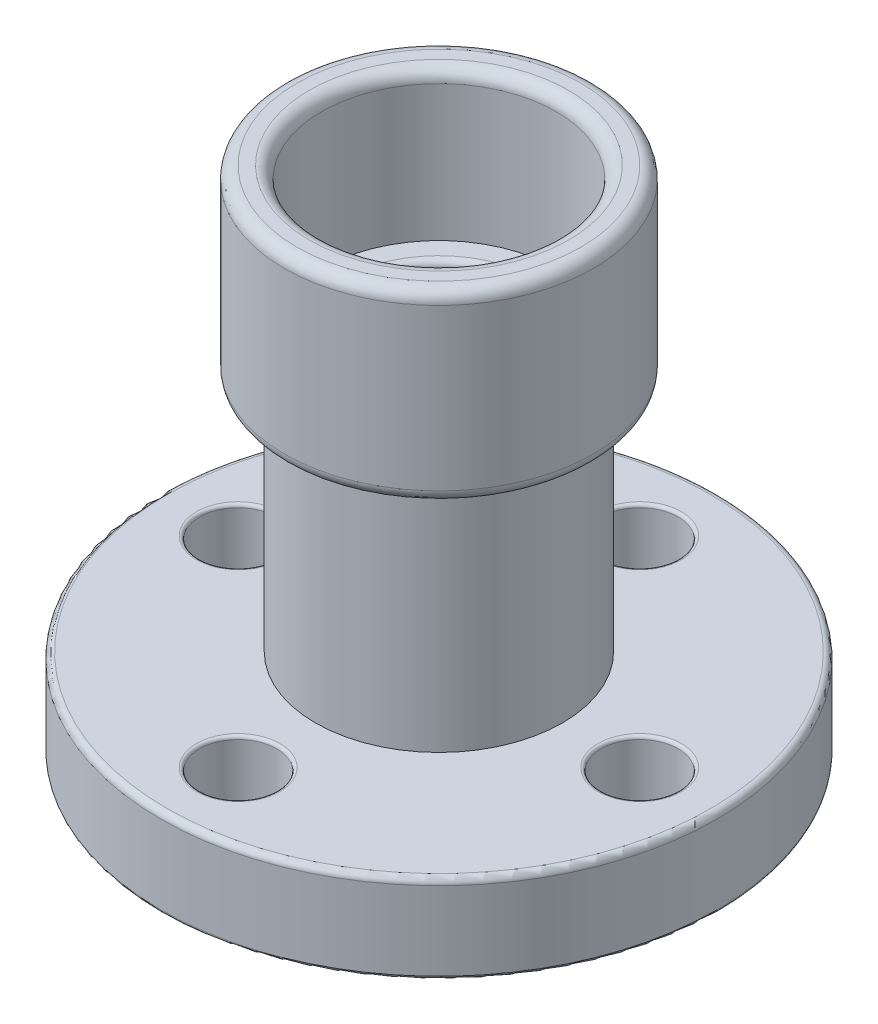
from build123d import *

# Parameters (mm, degrees)
SKETCH1_R           = 45
SKETCH1_R_2         = 20
SKETCH1_R_3         = 15
BOSS_EXTRUDE2_DEPTH = 14.2
BOSS_EXTRUDE3_START = 44.2
SKETCH2_R           = 20
SKETCH2_R_2         = 15
BOSS_EXTRUDE3_DEPTH = 44.2
BOSS_EXTRUDE4_START = 24
SKETCH3_R           = 25
SKETCH3_R_2         = 20
SKETCH3_R_3         = 19
BOSS_EXTRUDE4_DEPTH = 24
SKETCH4_R           = 25
SKETCH4_R_2         = 15
BOSS_EXTRUDE5_DEPTH = 6
SKETCH5_R           = 6.25
CUT_EXTRUDE1_DEPTH  = 24
FILLET1_R           = 1
FILLET2_R           = 2
FILLET3_R           = 1
FILLET4_R           = 0.5
FILLET5_R           = 0.5
FILLET6_R           = 1


with BuildPart() as part:
    # Sketch1 → Boss-Extrude2 (new body)
    # profile 1 of 2: a face of its own
    with BuildSketch(Plane(origin=(0, 0, 0), x_dir=(1, 0, 0), z_dir=(0, 1, 0))):
        with Locations(Location((0, 0, 0), (0, 0, 270))):
            Circle(SKETCH1_R)
        Circle(SKETCH1_R_2, mode=Mode.SUBTRACT)
    # profile 2 of 2: a face of its own
    with BuildSketch(Plane(origin=(0, 0, 0), x_dir=(1, 0, 0), z_dir=(0, 1, 0))):
        Circle(SKETCH1_R_2)
        with Locations(Location((0, 0, 0), (0, 0, 270))):
            Circle(SKETCH1_R_3, mode=Mode.SUBTRACT)
    extrude(amount=-BOSS_EXTRUDE2_DEPTH)

    # Sketch2 → Boss-Extrude3 (add)
    with BuildSketch(Plane(origin=(0, 0, 0), x_dir=(1, 0, 0), z_dir=(0, 1, 0)).offset(BOSS_EXTRUDE3_START)):
        with Locations(Location((0, 0, 0), (0, 0, 270))):
            Circle(SKETCH2_R)
        with Locations(Location((0, 0, 0), (0, 0, 270))):
            Circle(SKETCH2_R_2, mode=Mode.SUBTRACT)
    extrude(amount=-BOSS_EXTRUDE3_DEPTH)

    # Sketch3 → Boss-Extrude4 (add)
    # profile 1 of 2: a face of its own
    with BuildSketch(Plane(origin=(0, 44.2, 0), x_dir=(1, 0, 0), z_dir=(0, 1, 0)).offset(BOSS_EXTRUDE4_START)):
        with Locations(Location((0, 0, 0), (0, 0, 270))):
            Circle(SKETCH3_R)
        with Locations(Location((0, 0, 0), (0, 0, 270))):
            Circle(SKETCH3_R_2, mode=Mode.SUBTRACT)
    # profile 2 of 2: a face of its own
    with BuildSketch(Plane(origin=(0, 44.2, 0), x_dir=(1, 0, 0), z_dir=(0, 1, 0)).offset(BOSS_EXTRUDE4_START)):
        with Locations(Location((0, 0, 0), (0, 0, 270))):
            Circle(SKETCH3_R_2)
        with Locations(Location((0, 0, 0), (0, 0, 270))):
            Circle(SKETCH3_R_3, mode=Mode.SUBTRACT)
    extrude(amount=-BOSS_EXTRUDE4_DEPTH)

    # Sketch4 → Boss-Extrude5 (add)
    with BuildSketch(Plane.XZ.offset(-44.2)):
        with Locations(Location((0, 0, 0), (0, 0, 270))):
            Circle(SKETCH4_R)
        with Locations(Location((0, 0, 0), (0, 0, 90))):
            Circle(SKETCH4_R_2, mode=Mode.SUBTRACT)
    extrude(amount=BOSS_EXTRUDE5_DEPTH)

    # Sketch5 → Cut-Extrude1 (cut)
    with BuildSketch(Plane(origin=(0, 0, 0), x_dir=(1, 0, 0), z_dir=(0, 1, 0))):
        with Locations(Location((0, 32.5, 0), (0, 0, 270))):
            Circle(SKETCH5_R)
        with Locations(Location((32.5, 0, 0), (0, 0, 270))):
            Circle(SKETCH5_R)
        with Locations(Location((0, -32.5, 0), (0, 0, 270))):
            Circle(SKETCH5_R)
        with Locations(Location((-32.5, 0, 0), (0, 0, 270))):
            Circle(SKETCH5_R)
    extrude(amount=-CUT_EXTRUDE1_DEPTH, mode=Mode.SUBTRACT)

    # Fillet1
    fillet1_edges = [part.edges().sort_by_distance(p)[0] for p in [
        (0, 0, -45),
    ]]
    fillet(fillet1_edges, radius=FILLET1_R)

    # Fillet2
    fillet2_edges = [part.edges().sort_by_distance(p)[0] for p in [
        (0, 68.2, -19),
        (0, 68.2, -25),
        (0, 38.2, 25),
    ]]
    fillet(fillet2_edges, radius=FILLET2_R)

    # Fillet3
    fillet3_edges = [part.edges().sort_by_distance(p)[0] for p in [
        (0, 44.2, -15),
    ]]
    fillet(fillet3_edges, radius=FILLET3_R)

    # Fillet4
    fillet4_edges = [part.edges().sort_by_distance(p)[0] for p in [
        (0, 0, -38.75),
        (32.5, 0, -6.25),
        (0, 0, 26.25),
        (-32.5, 0, -6.25),
    ]]
    fillet(fillet4_edges, radius=FILLET4_R)

    # Fillet5
    fillet5_edges = [part.edges().sort_by_distance(p)[0] for p in [
        (0, -14.2, -45),
    ]]
    fillet(fillet5_edges, radius=FILLET5_R)

    # Fillet6
    fillet6_edges = [part.edges().sort_by_distance(p)[0] for p in [
        (0, -14.2, -15),
    ]]
    fillet(fillet6_edges, radius=FILLET6_R)


solid = part.part
